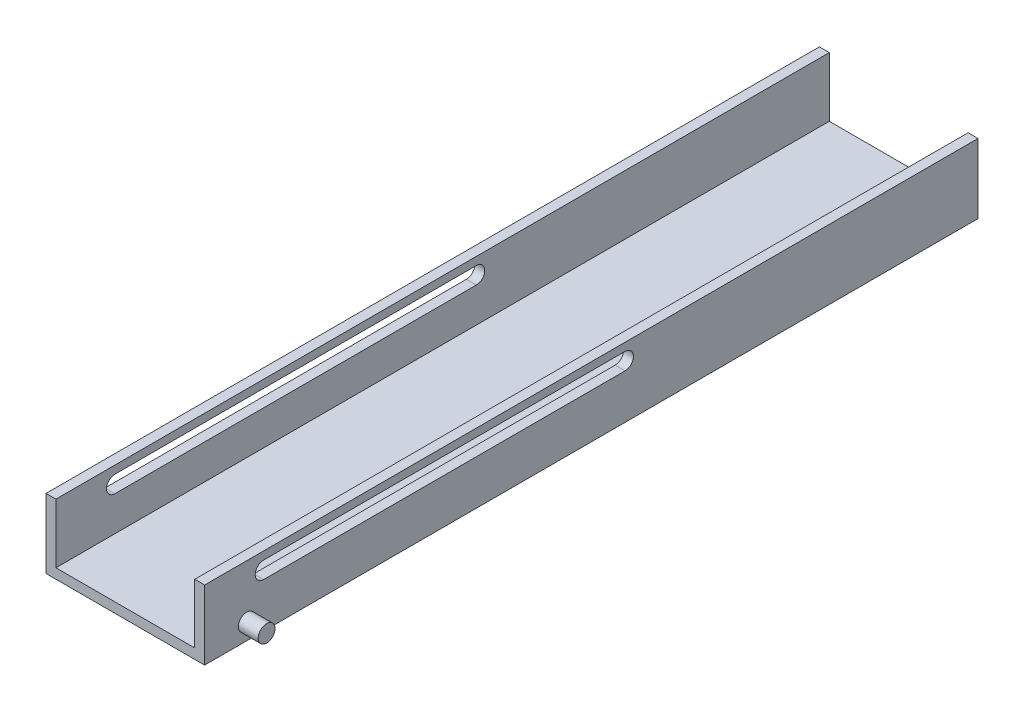
from build123d import *

# Parameters (mm, degrees)
SKETCH1_W           = 40
SKETCH1_H           = 200
BOSS_EXTRUDE1_DEPTH = 20
SKETCH2_R           = 2.125
BOSS_EXTRUDE2_DEPTH = 5
BOSS_EXTRUDE3_START = 5
SKETCH3_R           = 2.125
BOSS_EXTRUDE3_DEPTH = 5
SKETCH4_W           = 35
SKETCH4_H           = 35
CUT_EXTRUDE1_DEPTH  = 210.5
CUT_EXTRUDE2_DEPTH  = 210.5
CUT_EXTRUDE3_DEPTH  = 210.5
BOSS_EXTRUDE4_DEPTH = 40
SKETCH8_W           = 35
SKETCH8_H           = 4.25
CUT_EXTRUDE4_DEPTH  = 141
CUT_EXTRUDE5_DEPTH  = 50
BOSS_EXTRUDE5_DEPTH = 40
SKETCH16_W          = 35
SKETCH16_H          = 4.25
CUT_EXTRUDE6_DEPTH  = 40
SKETCH17_W          = 6.375
SKETCH17_H          = 17.5
CUT_EXTRUDE7_DEPTH  = 53
BOSS_EXTRUDE6_DEPTH = 6.375


with BuildPart() as part:
    # Sketch1 → Boss-Extrude1 (new body)
    with BuildSketch(Plane(origin=(0, 0, 0), x_dir=(1, 0, 0), z_dir=(0, 1, 0))):
        Rectangle(SKETCH1_W, SKETCH1_H)
    extrude(amount=BOSS_EXTRUDE1_DEPTH)

    # Sketch2 → Boss-Extrude2 (add)
    with BuildSketch(Plane(origin=(20, 0, 0), x_dir=(0, 0, -1), z_dir=(1, 0, 0))):
        with Locations(Location((-95.75, 4.125, 0), (0, 0, 180))):
            Circle(SKETCH2_R)
    extrude(amount=BOSS_EXTRUDE2_DEPTH)

    # Sketch3 → Boss-Extrude3 (add)
    with BuildSketch(Plane.ZY.offset(20).offset(BOSS_EXTRUDE3_START)):
        with Locations((95.75, 4.125)):
            Circle(SKETCH3_R)
    extrude(amount=-BOSS_EXTRUDE3_DEPTH)

    # Sketch4 → Cut-Extrude1 (cut)
    with BuildSketch(Plane.XY.offset(100)):
        with Locations((0, 20)):
            Rectangle(SKETCH4_W, SKETCH4_H)
    extrude(amount=-CUT_EXTRUDE1_DEPTH, mode=Mode.SUBTRACT)

    # Sketch5 → Cut-Extrude2 (cut)
    with BuildSketch(Plane.ZY.offset(20)):
        Polygon((-100, 0), (-95, 0), (-95, 17.5), (100, 17.5), (100, 20), (-100, 20), align=None)
    extrude(amount=-CUT_EXTRUDE2_DEPTH, mode=Mode.SUBTRACT)

    # Sketch6 → Cut-Extrude3 (cut)
    with BuildSketch(Plane.ZY.offset(20)):
        with BuildLine():
            Line((-90.75, 15.5), (95.75, 15.5))
            ThreePointArc((95.75, 15.5), (97.875, 13.375), (95.75, 11.25))
            Line((95.75, 11.25), (-90.75, 11.25))
            ThreePointArc((-90.75, 11.25), (-92.875, 13.375), (-90.75, 15.5))
        make_face()
    extrude(amount=-CUT_EXTRUDE3_DEPTH, mode=Mode.SUBTRACT)

    # Sketch7 → Boss-Extrude4 (add)
    with BuildSketch(Plane.ZY.offset(20)):
        with BuildLine():
            Line((6.75, 11.25), (-95, 11.25))
            Line((-95, 11.25), (-95, 15.5))
            Line((-95, 15.5), (6.75, 15.5))
            ThreePointArc((6.75, 15.5), (4.625, 13.375), (6.75, 11.25))
        make_face()
    extrude(amount=-BOSS_EXTRUDE4_DEPTH)

    # Sketch8 → Cut-Extrude4 (cut)
    with BuildSketch(Plane(origin=(0, 0, -95), x_dir=(-1, 0, 0), z_dir=(0, 0, -1))):
        with Locations((0, 13.375)):
            Rectangle(SKETCH8_W, SKETCH8_H)
    extrude(amount=-CUT_EXTRUDE4_DEPTH, mode=Mode.SUBTRACT)

    # Sketch14 → Cut-Extrude5 (cut)
    with BuildSketch(Plane.ZY.offset(20)):
        with BuildLine():
            Line((0.375, 11.25), (6.75, 11.25))
            Line((6.75, 11.25), (6.75, 15.5))
            Line((6.75, 15.5), (0.375, 15.5))
            ThreePointArc((0.375, 15.5), (-1.75, 13.375), (0.375, 11.25))
        make_face()
    extrude(amount=-CUT_EXTRUDE5_DEPTH, mode=Mode.SUBTRACT)

    # Sketch15 → Boss-Extrude5 (add)
    with BuildSketch(Plane.ZY.offset(20)):
        with BuildLine():
            Line((95.75, 15.5), (91.5, 15.5))
            ThreePointArc((91.5, 15.5), (93.625, 13.375), (91.5, 11.25))
            Line((91.5, 11.25), (95.75, 11.25))
            ThreePointArc((95.75, 11.25), (97.875, 13.375), (95.75, 15.5))
        make_face()
    extrude(amount=-BOSS_EXTRUDE5_DEPTH)

    # Sketch16 → Cut-Extrude6 (cut)
    with BuildSketch(Plane.XY.offset(100)):
        with Locations((0, 13.375)):
            Rectangle(SKETCH16_W, SKETCH16_H)
    extrude(amount=-CUT_EXTRUDE6_DEPTH, mode=Mode.SUBTRACT)

    # Sketch17 → Cut-Extrude7 (cut)
    with BuildSketch(Plane.ZY.offset(20)):
        with Locations((-91.8125, 8.75)):
            Rectangle(SKETCH17_W, SKETCH17_H)
    extrude(amount=-CUT_EXTRUDE7_DEPTH, mode=Mode.SUBTRACT)

    # Sketch18 → Boss-Extrude6 (add)
    with BuildSketch(Plane.XY.offset(100)):
        Polygon((-20, 17.5), (-17.5, 17.5), (-17.5, 2.5), (17.5, 2.5), (17.5, 17.5), (20, 17.5), (20, 0), (-20, 0), align=None)
    extrude(amount=BOSS_EXTRUDE6_DEPTH)


solid = part.part
